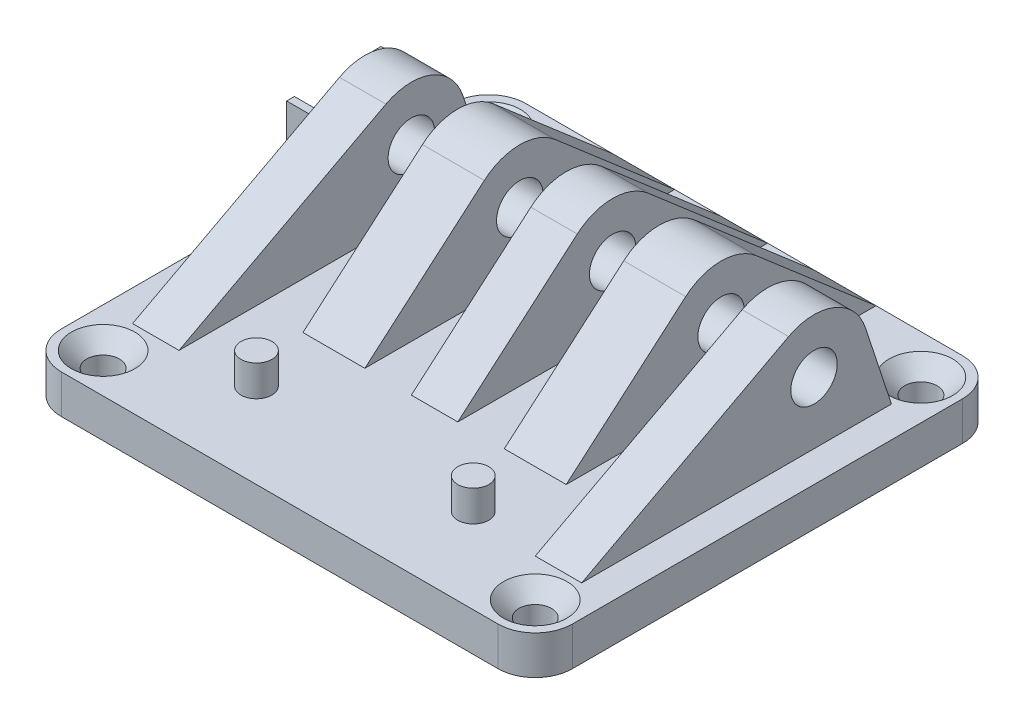
from build123d import *

# Parameters (mm, degrees)
SKETCH4_W           = 6
SKETCH4_H           = 40
SKETCH4_W_2         = 8
BOSS_EXTRUDE4_DEPTH = 5
SKETCH6_W           = 6
SKETCH6_H           = 40
SKETCH6_W_2         = 8
BOSS_EXTRUDE5_DEPTH = 15
SKETCH7_R           = 3
CUT_EXTRUDE2_DEPTH  = 73.773621595
CUT_EXTRUDE3_REACH  = 74.774
CUT_EXTRUDE4_REACH  = 90.566
CUT_EXTRUDE5_REACH  = 92.449
SKETCH10_R          = 2.1
CHAMFER1_SIZE       = 2
FILLET1_R           = 4.8
SKETCH11_R          = 2
BOSS_EXTRUDE6_DEPTH = 4
BOSS_EXTRUDE7_DEPTH = 4


with BuildPart() as part:
    # Sketch4 → Boss-Extrude4 (new body)
    with BuildSketch(Plane(origin=(0, 0, 0), x_dir=(1, 0, 0), z_dir=(0, 1, 0))):
        Polygon((0, 60), (0, 0), (66, 0), (66, 60), (56, 60), (56, 50), (62, 50), (62, 10), (56, 10), (56, 20), (50, 20), (42, 20), (36, 20), (30, 20), (30, 60), align=None)
        with Locations((39, 40)):
            Rectangle(SKETCH4_W, SKETCH4_H)
        with Locations((33, 40)):
            Rectangle(SKETCH4_W, SKETCH4_H)
        with Locations((46, 40)):
            Rectangle(SKETCH4_W_2, SKETCH4_H)
        Polygon((56, 50), (56, 60), (50, 60), (50, 20), (56, 20), align=None)
        Polygon((62, 50), (56, 50), (56, 20), (56, 10), (62, 10), align=None)
    extrude(amount=BOSS_EXTRUDE4_DEPTH)

    # Sketch6 → Boss-Extrude5 (add)
    with BuildSketch(Plane(origin=(0, 5, 0), x_dir=(1, 0, 0), z_dir=(0, 1, 0))):
        with Locations((33, 40)):
            Rectangle(SKETCH6_W, SKETCH6_H)
        with Locations((46, 40)):
            Rectangle(SKETCH6_W_2, SKETCH6_H)
        Polygon((62, 50), (56, 50), (56, 20), (56, 10), (62, 10), align=None)
    boss_extrude5 = extrude(amount=BOSS_EXTRUDE5_DEPTH)

    # Sketch7 → Cut-Extrude2 (cut, through all)
    with BuildSketch(Plane.ZY.offset(-30)):
        with Locations(Location((-40, 13, 0), (0, 0, 180))):
            Circle(SKETCH7_R)
    cut_extrude2 = extrude(amount=-CUT_EXTRUDE2_DEPTH, mode=Mode.SUBTRACT)

    # Cut-Extrude3: up to this face of the body (flat: up to its plane)
    cut_extrude3_end = Plane(part.part.faces().sort_by_distance((50, 12.5, -20.427200187))[0])
    # Sketch8 → Cut-Extrude3 (cut, up to the picked face)
    with BuildSketch(Plane.ZY.offset(-30), mode=Mode.PRIVATE) as cut_extrude3_sk1:
        with BuildLine():
            Line((-60, 20), (-60, 5))
            Line((-60, 5), (-44.570704164, 18.30176041))
            ThreePointArc((-44.570704164, 18.30176041), (-42.437998885, 19.561719396), (-40, 20))
            Line((-40, 20), (-60, 20))
        make_face()
    cut_extrude3_tool1 = split(extrude(cut_extrude3_sk1.sketch, amount=-CUT_EXTRUDE3_REACH, mode=Mode.PRIVATE), bisect_by=cut_extrude3_end, keep=Keep.BOTH, mode=Mode.PRIVATE)
    # Sketch8 → Cut-Extrude3 (cut, up to the picked face)
    with BuildSketch(Plane.ZY.offset(-30), mode=Mode.PRIVATE) as cut_extrude3_sk2:
        with BuildLine():
            Line((-35.429295836, 18.30176041), (-20, 5))
            Line((-20, 5), (-20, 20))
            Line((-20, 20), (-40, 20))
            ThreePointArc((-40, 20), (-37.562001115, 19.561719396), (-35.429295836, 18.30176041))
        make_face()
    cut_extrude3_tool2 = split(extrude(cut_extrude3_sk2.sketch, amount=-CUT_EXTRUDE3_REACH, mode=Mode.PRIVATE), bisect_by=cut_extrude3_end, keep=Keep.BOTH, mode=Mode.PRIVATE)
    cut_extrude3_1 = cut_extrude3_tool1.solids().sort_by(Axis((30, 15.027454, -54.131076), (1, 0, 0)))[0]
    add(cut_extrude3_1, mode=Mode.SUBTRACT)
    cut_extrude3_2 = cut_extrude3_tool2.solids().sort_by(Axis((30, 15.027454, -25.868924), (1, 0, 0)))[0]
    add(cut_extrude3_2, mode=Mode.SUBTRACT)
    cut_extrude3 = cut_extrude3_1 + cut_extrude3_2  # Cut-Extrude3 as one shape, for the pattern or mirror that repeats it

    # Sketch9 → Cut-Extrude4 (cut, up to next)
    with BuildSketch(Plane(origin=(62, 0, 0), x_dir=(0, 0, -1), z_dir=(1, 0, 0)), mode=Mode.PRIVATE) as cut_extrude4_sk1:
        with BuildLine():
            ThreePointArc((36.717902336, 19.182866239), (38.30885596, 19.792645422), (40, 20))
            Line((40, 20), (10, 20))
            Line((10, 20), (10, 5))
            Line((10, 5), (36.717902336, 19.182866239))
        make_face()
    cut_extrude4_tool1 = extrude(cut_extrude4_sk1.sketch, amount=-CUT_EXTRUDE4_REACH, mode=Mode.PRIVATE) & part.part
    # Sketch9 → Cut-Extrude4 (cut, up to next)
    with BuildSketch(Plane(origin=(62, 0, 0), x_dir=(0, 0, -1), z_dir=(1, 0, 0)), mode=Mode.PRIVATE) as cut_extrude4_sk2:
        with BuildLine():
            ThreePointArc((40, 20), (44.104331221, 18.67049074), (46.649592052, 15.186990065))
            Line((46.649592052, 15.186990065), (50, 5))
            Line((50, 5), (50, 20))
            Line((50, 20), (40, 20))
        make_face()
    cut_extrude4_tool2 = extrude(cut_extrude4_sk2.sketch, amount=-CUT_EXTRUDE4_REACH, mode=Mode.PRIVATE) & part.part
    cut_extrude4_1 = cut_extrude4_tool1.solids().sort_by_distance((62, 15.005539, -19.440707))[0]
    add(cut_extrude4_1, mode=Mode.SUBTRACT)
    cut_extrude4_2 = cut_extrude4_tool2.solids().sort_by_distance((62, 15.452907, -47.894979))[0]
    add(cut_extrude4_2, mode=Mode.SUBTRACT)
    cut_extrude4 = cut_extrude4_1 + cut_extrude4_2  # Cut-Extrude4 as one shape, for the pattern or mirror that repeats it

    # Mirror1: Boss-Extrude5, Cut-Extrude2, Cut-Extrude3, Cut-Extrude4 across plane
    add(boss_extrude5.mirror(Plane.ZY.offset(-33)))
    add(cut_extrude2.mirror(Plane.ZY.offset(-33)), mode=Mode.SUBTRACT)
    add(cut_extrude3.mirror(Plane.ZY.offset(-33)), mode=Mode.SUBTRACT)
    add(cut_extrude4.mirror(Plane.ZY.offset(-33)), mode=Mode.SUBTRACT)

    # Sketch10 → Cut-Extrude5 (cut, up to next)
    with BuildSketch(Plane(origin=(0, 5, 0), x_dir=(1, 0, 0), z_dir=(0, 1, 0)), mode=Mode.PRIVATE) as cut_extrude5_sk1:
        with Locations(Location((5.1, 54.9, 0), (0, 0, 270))):
            Circle(SKETCH10_R)
    cut_extrude5_tool1 = extrude(cut_extrude5_sk1.sketch, amount=-CUT_EXTRUDE5_REACH, mode=Mode.PRIVATE) & part.part
    # Sketch10 → Cut-Extrude5 (cut, up to next)
    with BuildSketch(Plane(origin=(0, 5, 0), x_dir=(1, 0, 0), z_dir=(0, 1, 0)), mode=Mode.PRIVATE) as cut_extrude5_sk2:
        with Locations(Location((60.9, 54.9, 0), (0, 0, 270))):
            Circle(SKETCH10_R)
    cut_extrude5_tool2 = extrude(cut_extrude5_sk2.sketch, amount=-CUT_EXTRUDE5_REACH, mode=Mode.PRIVATE) & part.part
    # Sketch10 → Cut-Extrude5 (cut, up to next)
    with BuildSketch(Plane(origin=(0, 5, 0), x_dir=(1, 0, 0), z_dir=(0, 1, 0)), mode=Mode.PRIVATE) as cut_extrude5_sk3:
        with Locations(Location((60.9, 5.1, 0), (0, 0, 270))):
            Circle(SKETCH10_R)
    cut_extrude5_tool3 = extrude(cut_extrude5_sk3.sketch, amount=-CUT_EXTRUDE5_REACH, mode=Mode.PRIVATE) & part.part
    # Sketch10 → Cut-Extrude5 (cut, up to next)
    with BuildSketch(Plane(origin=(0, 5, 0), x_dir=(1, 0, 0), z_dir=(0, 1, 0)), mode=Mode.PRIVATE) as cut_extrude5_sk4:
        with Locations(Location((5.1, 5.1, 0), (0, 0, 270))):
            Circle(SKETCH10_R)
    cut_extrude5_tool4 = extrude(cut_extrude5_sk4.sketch, amount=-CUT_EXTRUDE5_REACH, mode=Mode.PRIVATE) & part.part
    add(cut_extrude5_tool1.solids().sort_by_distance((5.1, 5, -54.9))[0], mode=Mode.SUBTRACT)
    add(cut_extrude5_tool2.solids().sort_by_distance((60.9, 5, -54.9))[0], mode=Mode.SUBTRACT)
    add(cut_extrude5_tool3.solids().sort_by_distance((60.9, 5, -5.1))[0], mode=Mode.SUBTRACT)
    add(cut_extrude5_tool4.solids().sort_by_distance((5.1, 5, -5.1))[0], mode=Mode.SUBTRACT)

    # Chamfer1
    chamfer1_edges = [part.edges().sort_by_distance(p)[0] for p in [
        (5.1, 5, -7.2),
        (60.9, 5, -7.2),
        (60.9, 5, -57),
        (5.1, 5, -57),
    ]]
    chamfer(chamfer1_edges, length=CHAMFER1_SIZE)

    # Fillet1
    fillet1_edges = [part.edges().sort_by_distance(p)[0] for p in [
        (66, 2.5, 0),
        (0, 2.5, 0),
        (0, 2.5, -60),
        (66, 2.5, -60),
    ]]
    fillet(fillet1_edges, radius=FILLET1_R)

    # Sketch11 → Boss-Extrude6 (add)
    with BuildSketch(Plane(origin=(0, 5, 0), x_dir=(1, 0, 0), z_dir=(0, 1, 0))):
        with Locations(Location((19, 11, 0), (0, 0, 270))):
            Circle(SKETCH11_R)
        with Locations(Location((47, 11, 0), (0, 0, 270))):
            Circle(SKETCH11_R)
    extrude(amount=BOSS_EXTRUDE6_DEPTH)

    # Sketch12 → Boss-Extrude7 (add)
    with BuildSketch(Plane.ZY.offset(-4)):
        Polygon((-45.1, 10.055513627), (-45.1, 15.944486373), (-46.1, 15.944486373), (-46.1, 5), (-33.9, 5), (-33.9, 15.944486373), (-34.9, 15.944486373), (-34.9, 10.055513627), (-40, 7.111027254), align=None)
    extrude(amount=BOSS_EXTRUDE7_DEPTH)


solid = part.part
